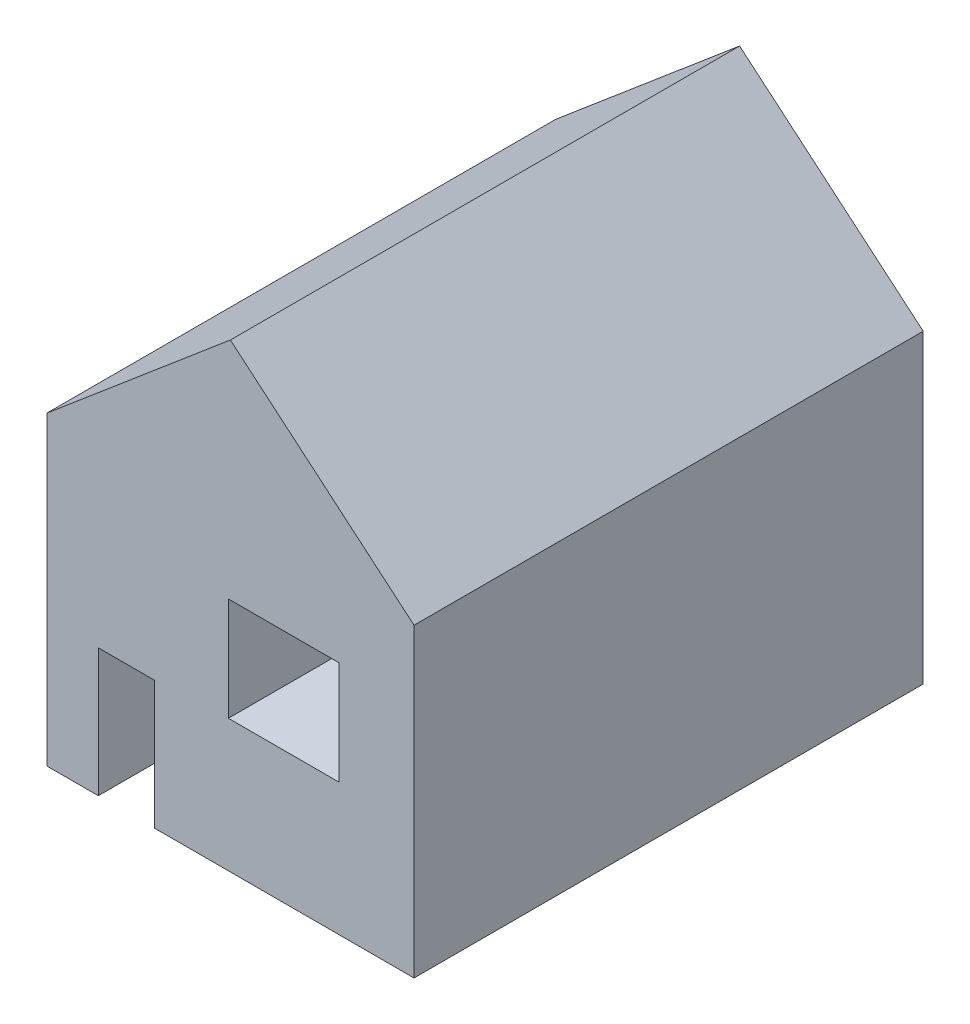
from build123d import *

# Parameters (mm, degrees)
SKETCH1_W           = 17.377025631
SKETCH1_H           = 16.239323069
BOSS_EXTRUDE1_DEPTH = 80
BOSS_EXTRUDE2_DEPTH = 80


with BuildPart() as part:
    # Sketch1 → Boss-Extrude1 (new body)
    with BuildSketch(Plane.XY):
        Polygon((-25.191985327, 24.243899858), (-82.889758174, 24.243899858), (-82.889758174, -23.756100142), (-74.789758174, -23.756100142), (-74.789758174, -3.629600036), (-65.986748664, -3.629600036), (-65.986748664, -23.756100142), (-25.191985327, -23.756100142), align=None)
        with Locations((-45.670631465, 5.119661535)):
            Rectangle(SKETCH1_W, SKETCH1_H, mode=Mode.SUBTRACT)
    extrude(amount=-BOSS_EXTRUDE1_DEPTH)

    # Sketch1<6> → Boss-Extrude2 (add)
    with BuildSketch(Plane.XY):
        Polygon((-54.040871751, 48.623240497), (-82.889758174, 24.243899858), (-25.191985327, 24.243899858), align=None)
    extrude(amount=-BOSS_EXTRUDE2_DEPTH)


solid = part.part
